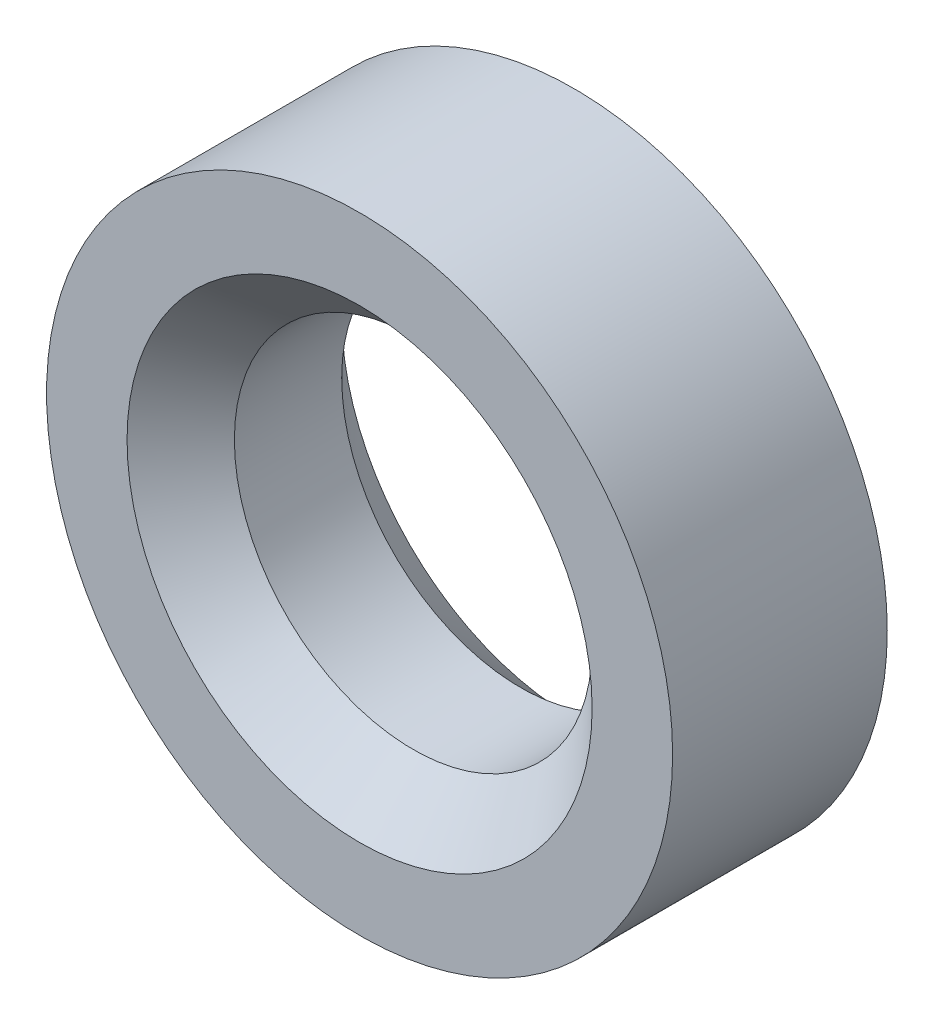
from build123d import *

# Parameters (mm, degrees)
SKETCH1_R           = 3.5
SKETCH1_R_2         = 2
BOSS_EXTRUDE1_DEPTH = 1.2
CHAMFER1_SIZE       = 0.6


with BuildPart() as part:
    # Sketch1 → Boss-Extrude1 (new, symmetric)
    with BuildSketch(Plane.XY):
        Circle(SKETCH1_R)
        Circle(SKETCH1_R_2, mode=Mode.SUBTRACT)
    extrude(amount=BOSS_EXTRUDE1_DEPTH, both=True)

    # Chamfer1
    chamfer1_edges = [part.edges().sort_by_distance(p)[0] for p in [
        (-2, 0, -1.2),
        (-2, 0, 1.2),
    ]]
    chamfer(chamfer1_edges, length=CHAMFER1_SIZE)


solid = part.part
